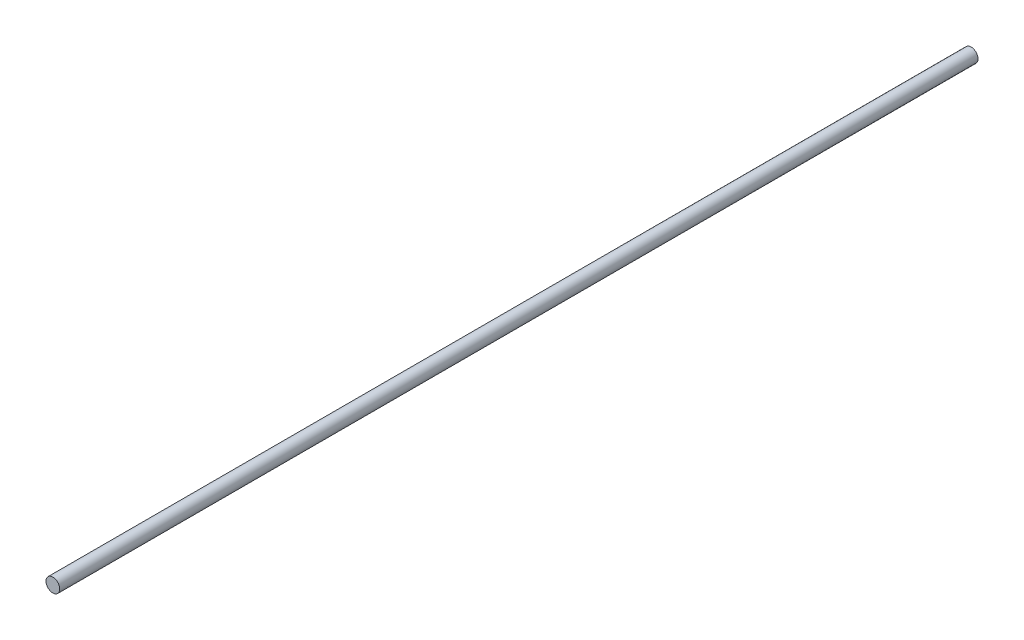
from build123d import *

# Parameters (mm, degrees)
ESQUISSE1_R        = 3
BOSS_EXTRU_1_DEPTH = 400


with BuildPart() as part:
    # Esquisse1 → Boss.-Extru.1 (new body)
    with BuildSketch(Plane.XY):
        Circle(ESQUISSE1_R)
    extrude(amount=BOSS_EXTRU_1_DEPTH)


solid = part.part
